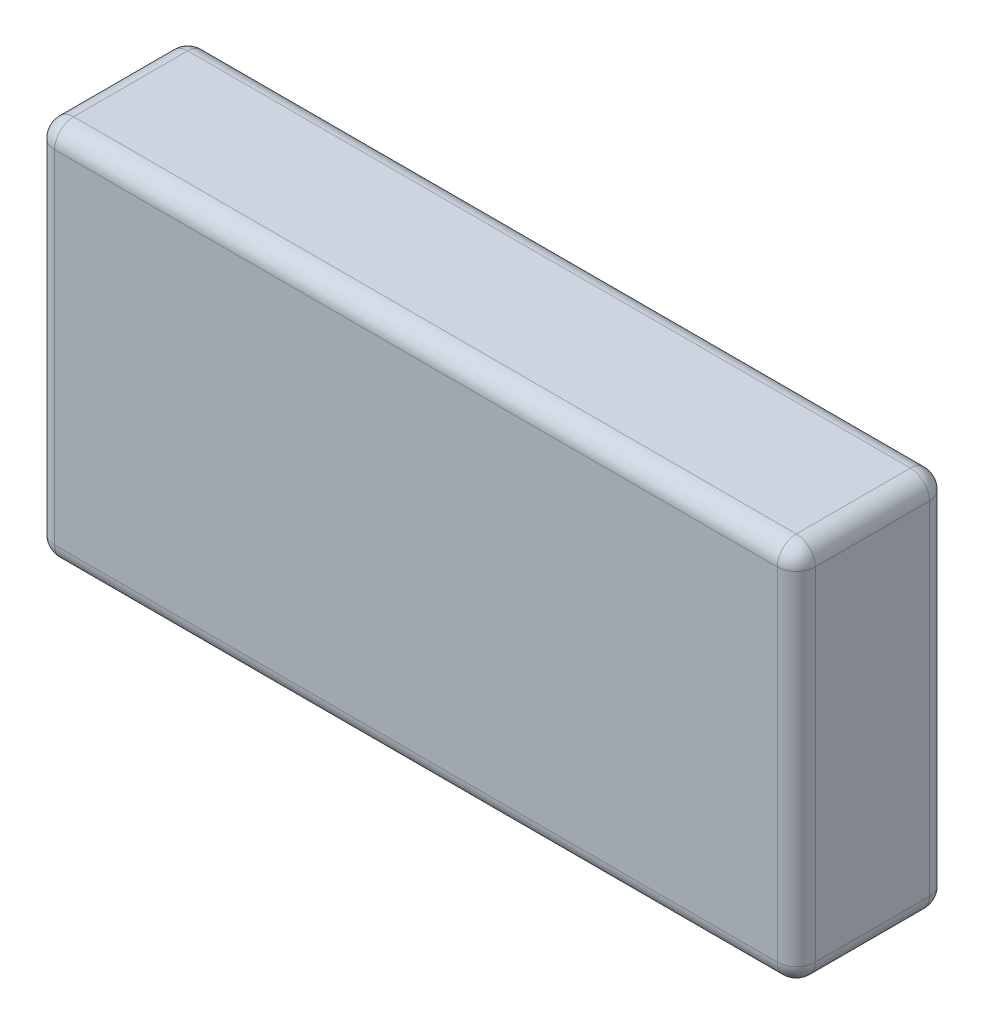
from build123d import *

# Parameters (mm, degrees)
SKETCH1_W           = 10
SKETCH1_H           = 2
BOSS_EXTRUDE1_DEPTH = 5
FILLET1_R           = 0.25


with BuildPart() as part:
    # Sketch1 → Boss-Extrude1 (new body)
    with BuildSketch(Plane(origin=(0, 0, 0), x_dir=(1, 0, 0), z_dir=(0, 1, 0))):
        Rectangle(SKETCH1_W, SKETCH1_H)
    extrude(amount=BOSS_EXTRUDE1_DEPTH)

    # Fillet1
    fillet1_edges = [part.edges().sort_by_distance(p)[0] for p in [
        (-5, 5, 0),
        (0, 5, 1),
        (5, 5, 0),
        (0, 0, 1),
        (-5, 0, 0),
        (0, 0, -1),
        (5, 0, 0),
        (5, 2.5, 1),
        (-5, 2.5, 1),
        (-5, 2.5, -1),
        (5, 2.5, -1),
        (0, 5, -1),
    ]]
    fillet(fillet1_edges, radius=FILLET1_R)


solid = part.part
